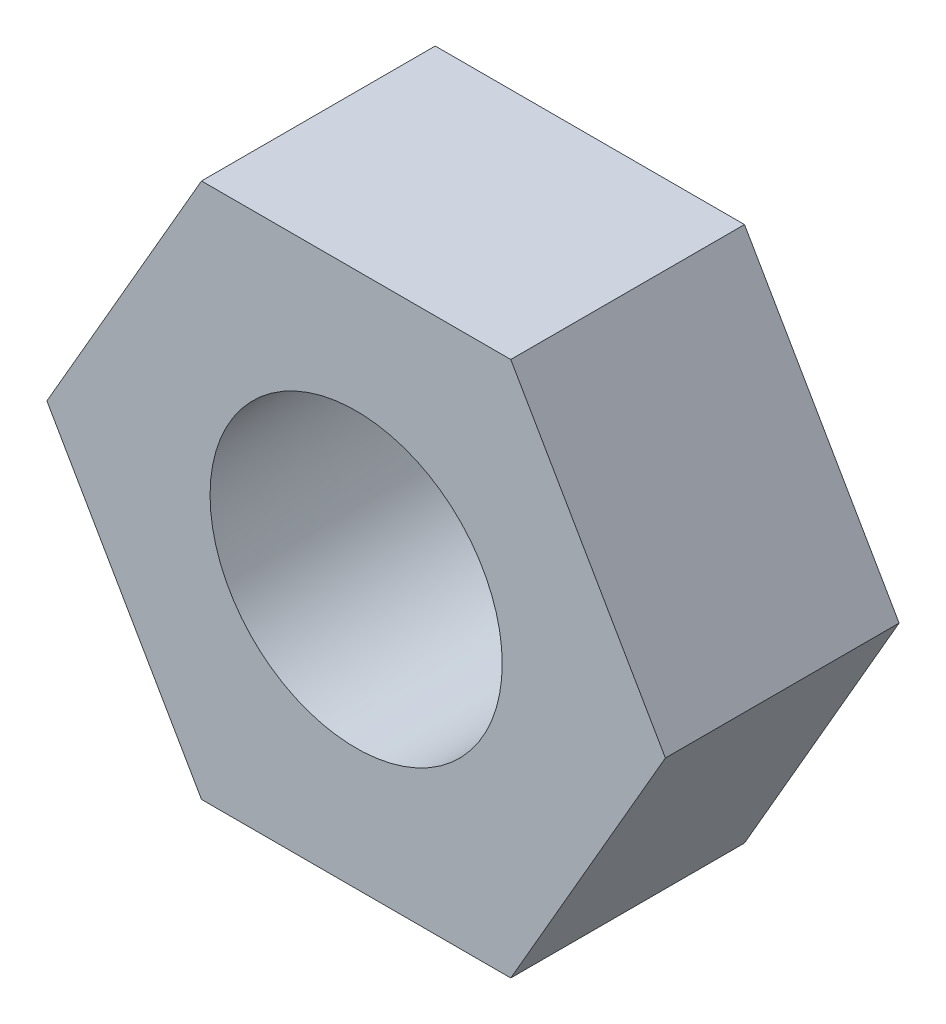
from build123d import *

# Parameters (mm, degrees)
BOSS_EXTRUDE1_DEPTH = 2.4
SKETCH2_R           = 1.5
CUT_EXTRUDE1_DEPTH  = 2.4


with BuildPart() as part:
    # Sketch1 → Boss-Extrude1 (new body)
    with BuildSketch(Plane.XY):
        Polygon((3.175426481, 0), (1.58771324, 2.75), (-1.58771324, 2.75), (-3.175426481, 0), (-1.58771324, -2.75), (1.58771324, -2.75), align=None)
    extrude(amount=BOSS_EXTRUDE1_DEPTH)

    # Sketch2 → Cut-Extrude1 (cut)
    with BuildSketch(Plane.XY.offset(2.4)):
        Circle(SKETCH2_R)
    extrude(amount=-CUT_EXTRUDE1_DEPTH, mode=Mode.SUBTRACT)


solid = part.part
